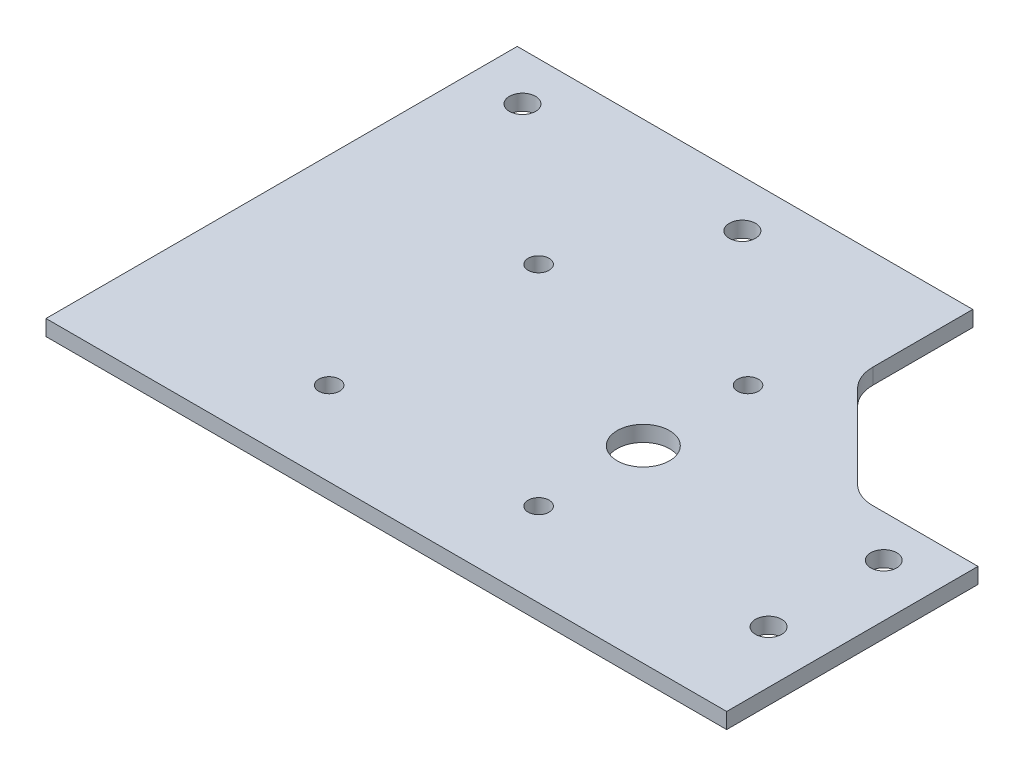
from build123d import *

# Parameters (mm, degrees)
SKETCH1_R           = 2.5
BOSS_EXTRUDE1_DEPTH = 3
SKETCH2_R           = 2
SKETCH2_R_2         = 5
CUT_EXTRUDE2_DEPTH  = 3


with BuildPart() as part:
    # Sketch1 → Boss-Extrude1 (new body)
    with BuildSketch(Plane(origin=(0, 0, 0), x_dir=(1, 0, 0), z_dir=(0, 1, 0))):
        with BuildLine():
            Line((0, -42), (-20.100505063, -42))
            ThreePointArc((-20.100505063, -42), (-22.77928909, -41.467156728), (-25.050252532, -39.949747468))
            Line((-25.050252532, -39.949747468), (-40.949747468, -24.050252532))
            ThreePointArc((-40.949747468, -24.050252532), (-42.467156728, -21.77928909), (-43, -19.100505063))
            Line((-43, -19.100505063), (-43, 0))
            Line((-43, 0), (-130, 0))
            Line((-130, 0), (-130, -90))
            Line((-130, -90), (0, -90))
            Line((0, -90), (0, -42))
        make_face()
        with Locations(Location((-78, -9, 0), (0, 0, 270))):
            Circle(SKETCH1_R, mode=Mode.SUBTRACT)
        with Locations(Location((-120, -9, 0), (0, 0, 270))):
            Circle(SKETCH1_R, mode=Mode.SUBTRACT)
        with Locations(Location((-10, -50, 0), (0, 0, 270))):
            Circle(SKETCH1_R, mode=Mode.SUBTRACT)
        with Locations(Location((-10, -72, 0), (0, 0, 270))):
            Circle(SKETCH1_R, mode=Mode.SUBTRACT)
    extrude(amount=BOSS_EXTRUDE1_DEPTH)

    # Sketch2 → Cut-Extrude2 (cut)
    with BuildSketch(Plane(origin=(0, 0, 0), x_dir=(1, 0, 0), z_dir=(0, 1, 0))):
        with Locations(Location((-51.919512874, -74, 0), (0, 0, 270))):
            Circle(SKETCH2_R)
        with Locations(Location((-51.919512874, -54, 0), (0, 0, 270))):
            Circle(SKETCH2_R_2)
        with Locations(Location((-51.919512874, -34, 0), (0, 0, 270))):
            Circle(SKETCH2_R)
        with Locations(Location((-91.919512874, -34, 0), (0, 0, 270))):
            Circle(SKETCH2_R)
        with Locations(Location((-91.919512874, -74, 0), (0, 0, 270))):
            Circle(SKETCH2_R)
    extrude(amount=CUT_EXTRUDE2_DEPTH, mode=Mode.SUBTRACT)


solid = part.part
